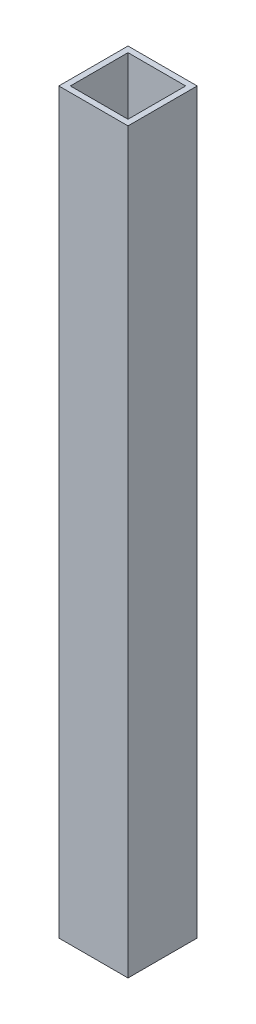
from build123d import *

# Parameters (mm, degrees)
SKETCH1_W           = 19.05
SKETCH1_H           = 19.05
SKETCH1_W_2         = 15.875
SKETCH1_H_2         = 15.875
BOSS_EXTRUDE1_DEPTH = 203.2


with BuildPart() as part:
    # Sketch1 → Boss-Extrude1 (new body)
    with BuildSketch(Plane(origin=(0, 0, 0), x_dir=(1, 0, 0), z_dir=(0, 1, 0))):
        with Locations((9.525, 9.525)):
            Rectangle(SKETCH1_W, SKETCH1_H)
        with Locations((9.525, 9.525)):
            Rectangle(SKETCH1_W_2, SKETCH1_H_2, mode=Mode.SUBTRACT)
    extrude(amount=BOSS_EXTRUDE1_DEPTH)


solid = part.part
